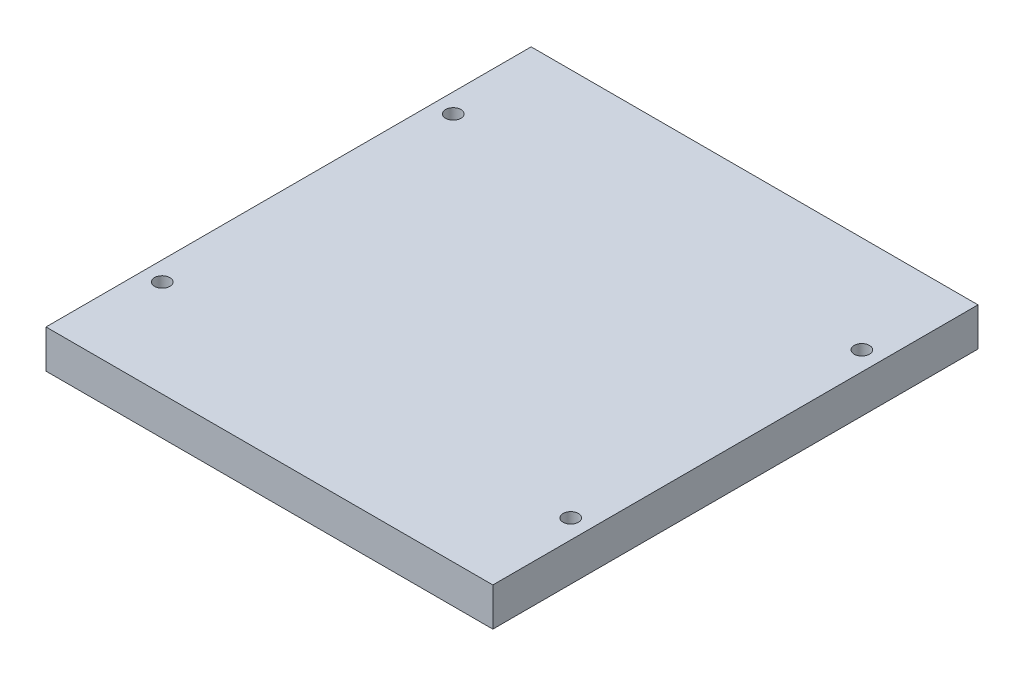
from build123d import *

# Parameters (mm, degrees)
SKETCH_1_W          = 35
SKETCH_1_H          = 38
EXTRUDE_1_DEPTH     = 3
SKETCH_2_R          = 0.6
CUT_EXTRUDE_1_DEPTH = 27.004807248
SKETCH_2_3_R        = 1
CUT_EXTRUDE_2_DEPTH = 1.5


with BuildPart() as part:
    # 草图1 → 凸台-拉伸1 (new body)
    with BuildSketch(Plane(origin=(0, 0, 0), x_dir=(1, 0, 0), z_dir=(0, 1, 0))):
        Rectangle(SKETCH_1_W, SKETCH_1_H)
    extrude(amount=EXTRUDE_1_DEPTH)

    # 草图2 → 切除-拉伸1 (cut, through all)
    with BuildSketch(Plane.XZ):
        with Locations((16, -11.4)):
            Circle(SKETCH_2_R)
        with Locations((16, 11.4)):
            Circle(SKETCH_2_R)
        with Locations((-16, 11.4)):
            Circle(SKETCH_2_R)
        with Locations((-16, -11.4)):
            Circle(SKETCH_2_R)
    extrude(amount=-CUT_EXTRUDE_1_DEPTH, mode=Mode.SUBTRACT)

    # 草图2<3> → 切除-拉伸2 (cut)
    with BuildSketch(Plane.XZ):
        with Locations((16, -11.4)):
            Circle(SKETCH_2_3_R)
        with Locations((16, 11.4)):
            Circle(SKETCH_2_3_R)
        with Locations((-16, 11.4)):
            Circle(SKETCH_2_3_R)
        with Locations((-16, -11.4)):
            Circle(SKETCH_2_3_R)
    extrude(amount=-CUT_EXTRUDE_2_DEPTH, mode=Mode.SUBTRACT)


solid = part.part
